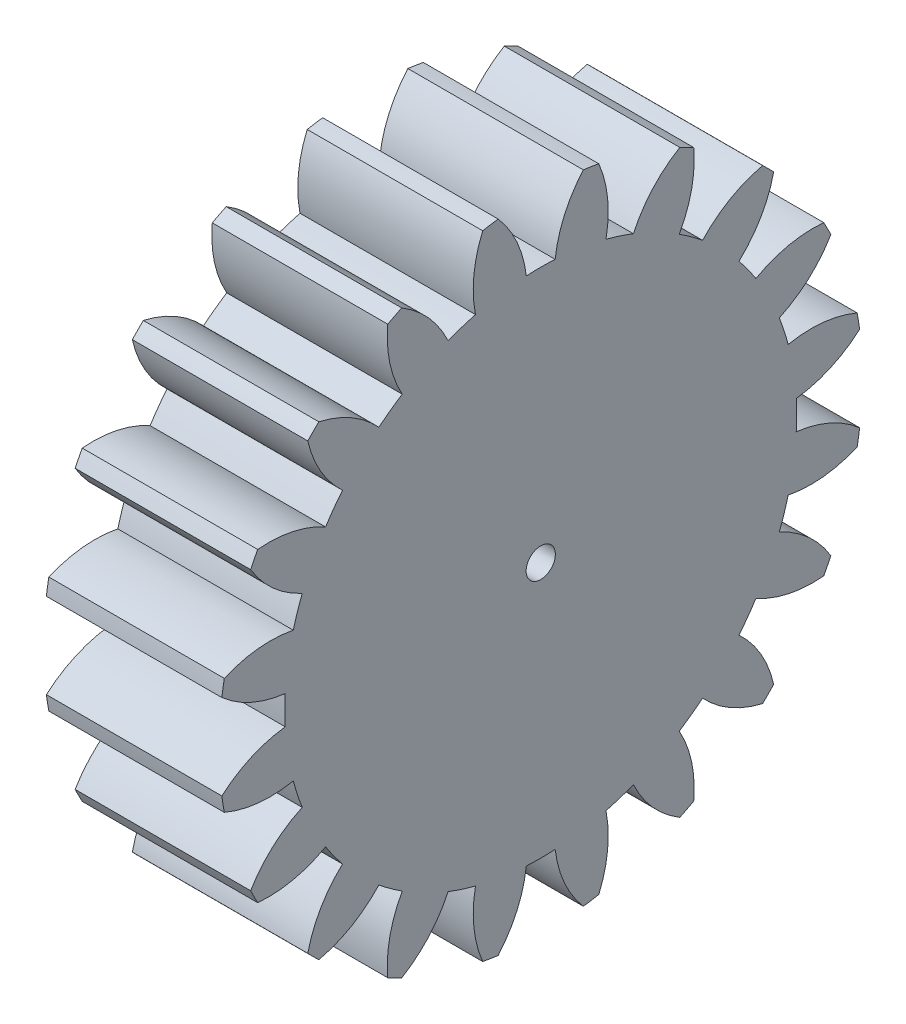
from build123d import *

# Parameters (mm, degrees)
BASPROSKE_W     = 30
BASPROSKE_H     = 55
TOOTHCUT_DEPTH  = 84.366660003
TEETHCUTS_COUNT = 20
TEETHCUTS_ANGLE = 342
BORSKE_R        = 2.5
BORE_DEPTH      = 50.0000508
SKETCH_1_R      = 2
EXTRUDE_1_DEPTH = 10


with BuildPart() as part:
    # BasProSke → Base-Revolve (revolve)
    with BuildSketch(Plane(origin=(0, 0, 0), x_dir=(1, 0, 0), z_dir=(0, 1, 0)), mode=Mode.PRIVATE) as base_revolve_sk:
        with Locations((15, 27.5)):
            Rectangle(BASPROSKE_W, BASPROSKE_H)
    revolve(base_revolve_sk.sketch.rotate(Axis((-10, 0, 0), (1, 0, 0)), 180), axis=Axis((-10, 0, 0), (1, 0, 0)))

    # TooCutSke → ToothCut (cut, through all)
    with BuildSketch(Plane(origin=(0, 0, 0), x_dir=(0, 0, -1), z_dir=(1, 0, 0))):
        with BuildLine():
            ThreePointArc((2.464838288, 43.679509764), (0, 43.749), (-2.464838288, 43.679509764))
            ThreePointArc((-2.464838288, 43.679509764), (-4.057398861, 49.476814676), (-7.300899231, 54.538899105))
            ThreePointArc((-7.300899231, 54.538899105), (0, 55.0254), (7.300899231, 54.538899105))
            ThreePointArc((7.300899231, 54.538899105), (4.057398861, 49.476814676), (2.464838288, 43.679509764))
        make_face()
    toothcut = extrude(amount=TOOTHCUT_DEPTH, mode=Mode.SUBTRACT)

    # TeethCuts: ToothCut ×20 about axis
    teethcuts_axis = Axis((-10, 0, 0), (1, 0, 0))
    for i in range(1, TEETHCUTS_COUNT):
        add(toothcut.rotate(teethcuts_axis, i * TEETHCUTS_ANGLE / (TEETHCUTS_COUNT - 1)), mode=Mode.SUBTRACT)

    # BorSke → Bore (cut, symmetric)
    with BuildSketch(Plane(origin=(0, 0, 0), x_dir=(0, 0, -1), z_dir=(1, 0, 0))):
        with Locations(Location((0, 0, 0), (0, 0, 180))):
            Circle(BORSKE_R)
    extrude(amount=BORE_DEPTH, both=True, mode=Mode.SUBTRACT)

    # 草图1 → 凸台-拉伸1 (add)
    with BuildSketch(Plane.ZY):
        with Locations(Location((0, -17.25, 0), (0, 0, 180))):
            Circle(SKETCH_1_R)
        with Locations(Location((-14.938938215, -8.625, 0), (0, 0, 180))):
            Circle(SKETCH_1_R)
        with Locations(Location((-14.938938215, 8.625, 0), (0, 0, 180))):
            Circle(SKETCH_1_R)
        with Locations(Location((0, 17.25, 0), (0, 0, 180))):
            Circle(SKETCH_1_R)
        with Locations(Location((14.938938215, 8.625, 0), (0, 0, 180))):
            Circle(SKETCH_1_R)
        with Locations(Location((14.938938215, -8.625, 0), (0, 0, 180))):
            Circle(SKETCH_1_R)
    extrude(amount=EXTRUDE_1_DEPTH)


solid = part.part
